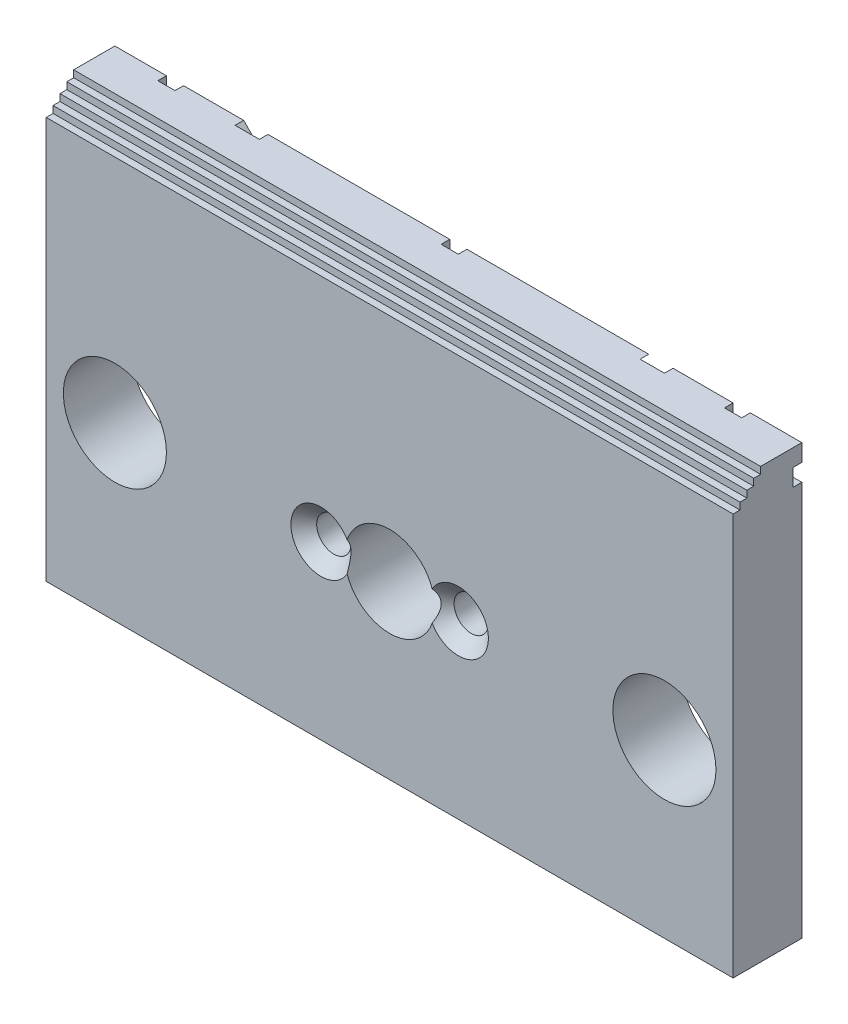
from build123d import *

# Parameters (mm, degrees)
SKETCH_1_W                     = 80
SKETCH_1_H                     = 60
EXTRUDE_1_DEPTH                = 8
HOLE_WIZARD_12_0_12_1_D        = 12
HOLE_WIZARD_10_5_10_5_1_D      = 10.5
HOLE_WIZARD_M3_5_1_D           = 4
HOLE_WIZARD_M3_5_1_CSINK_D     = 7
HOLE_WIZARD_M3_5_1_CSINK_ANGLE = 90
CUT_EXTRUDE_1_DEPTH            = 1
CUT_EXTRUDE_2_REACH            = 95.053
CUT_EXTRUDE_3_REACH            = 94.961
SKETCH_29_W                    = 80
SKETCH_29_H                    = 10


with BuildPart() as part:
    # 草图1 → 凸台-拉伸1 (new body)
    with BuildSketch(Plane(origin=(0, 0, 1), x_dir=(-1, 0, 0), z_dir=(0, 0, -1))):
        with Locations((-40, 16.666666667)):
            Rectangle(SKETCH_1_W, SKETCH_1_H)
    extrude(amount=-EXTRUDE_1_DEPTH)

    # Ø12.0 (12) 直径孔1 (through all)
    with Locations(Plane.XY.offset(9)):
        with Locations((72, 16.666666667), (8, 16.666666667)):
            Hole(HOLE_WIZARD_12_0_12_1_D / 2)

    # Ø10.5 (10.5) 直径孔1 (through all)
    with Locations(Plane(origin=(0, 0, 1), x_dir=(-1, 0, 0), z_dir=(0, 0, -1))):
        with Locations((-40, 16.666666667)):
            Hole(HOLE_WIZARD_10_5_10_5_1_D / 2)

    # M3.5 平头机械螺钉的锥形沉头孔1 (through all)
    with Locations(Plane.XY.offset(9)):
        with Locations((32, 16.666666667), (48, 16.666666667)):
            CounterSinkHole(HOLE_WIZARD_M3_5_1_D / 2, HOLE_WIZARD_M3_5_1_CSINK_D / 2, counter_sink_angle=HOLE_WIZARD_M3_5_1_CSINK_ANGLE)

    # 草图27 → 切除-拉伸1 (cut)
    with BuildSketch(Plane(origin=(0, 0, 1), x_dir=(-1, 0, 0), z_dir=(0, 0, -1))):
        with BuildLine():
            ThreePointArc((-41, 30.666666667), (-40, 29.666666667), (-39, 30.666666667))
            Line((-39, 30.666666667), (-39, 42.666666667))
            Line((-39, 42.666666667), (-21.828427125, 42.666666667))
            Line((-21.828427125, 42.666666667), (-32.414213562, 32.080880229))
            ThreePointArc((-32.414213562, 32.080880229), (-32.414213562, 30.666666667), (-31, 30.666666667))
            Line((-31, 30.666666667), (-19, 42.666666667))
            Line((-19, 42.666666667), (-8, 42.666666667))
            Line((-8, 42.666666667), (-8, 30.666666667))
            ThreePointArc((-8, 30.666666667), (-7, 29.666666667), (-6, 30.666666667))
            Line((-6, 30.666666667), (-6, 42.666666667))
            Line((-6, 42.666666667), (0, 42.666666667))
            Line((0, 42.666666667), (0, 44.666666667))
            Line((0, 44.666666667), (-6, 44.666666667))
            Line((-6, 44.666666667), (-6, 46.666666667))
            Line((-6, 46.666666667), (-8, 46.666666667))
            Line((-8, 46.666666667), (-8, 44.666666667))
            Line((-8, 44.666666667), (-17, 44.666666667))
            Line((-17, 44.666666667), (-15, 46.666666667))
            Line((-15, 46.666666667), (-16.414213562, 48.080880229))
            Line((-16.414213562, 48.080880229), (-19.828427125, 44.666666667))
            Line((-19.828427125, 44.666666667), (-39, 44.666666667))
            Line((-39, 44.666666667), (-39, 46.666666667))
            Line((-39, 46.666666667), (-41, 46.666666667))
            Line((-41, 46.666666667), (-41, 44.666666667))
            Line((-41, 44.666666667), (-60.171572875, 44.666666667))
            Line((-60.171572875, 44.666666667), (-63.585786438, 48.080880229))
            Line((-63.585786438, 48.080880229), (-65, 46.666666667))
            Line((-65, 46.666666667), (-63, 44.666666667))
            Line((-63, 44.666666667), (-72, 44.666666667))
            Line((-72, 44.666666667), (-72, 46.666666667))
            Line((-72, 46.666666667), (-74, 46.666666667))
            Line((-74, 46.666666667), (-74, 44.666666667))
            Line((-74, 44.666666667), (-80, 44.666666667))
            Line((-80, 44.666666667), (-80, 42.666666667))
            Line((-80, 42.666666667), (-74, 42.666666667))
            Line((-74, 42.666666667), (-74, 30.666666667))
            ThreePointArc((-74, 30.666666667), (-73, 29.666666667), (-72, 30.666666667))
            Line((-72, 30.666666667), (-72, 42.666666667))
            Line((-72, 42.666666667), (-61, 42.666666667))
            Line((-61, 42.666666667), (-49, 30.666666667))
            ThreePointArc((-49, 30.666666667), (-47.585786438, 30.666666667), (-47.585786438, 32.080880229))
            Line((-47.585786438, 32.080880229), (-58.171572875, 42.666666667))
            Line((-58.171572875, 42.666666667), (-41, 42.666666667))
            Line((-41, 42.666666667), (-41, 30.666666667))
        make_face()
    extrude(amount=-CUT_EXTRUDE_1_DEPTH, mode=Mode.SUBTRACT)

    # 草图28 → 切除-拉伸2 (cut, up to next)
    with BuildSketch(Plane.ZY, mode=Mode.PRIVATE) as cut_extrude_2_sk1:
        Polygon((9, 46.666666667), (5.8, 46.666666667), (5.8, 45.866666667), (6.6, 45.866666667), (6.6, 45.066666667), (7.4, 45.066666667), (7.4, 44.266666667), (8.2, 44.266666667), (8.2, 43.466666667), (9, 43.466666667), align=None)
    cut_extrude_2_tool1 = extrude(cut_extrude_2_sk1.sketch, amount=-CUT_EXTRUDE_2_REACH, mode=Mode.PRIVATE) & part.part
    add(cut_extrude_2_tool1.solids().sort_by_distance((0, 45.466667, 7.8))[0], mode=Mode.SUBTRACT)

    # 草图29 → 切除-拉伸3 (cut, up to next)
    with BuildSketch(Plane(origin=(0, 0, 1), x_dir=(-1, 0, 0), z_dir=(0, 0, -1)), mode=Mode.PRIVATE) as cut_extrude_3_sk1:
        with Locations((-40, -8.333333333)):
            Rectangle(SKETCH_29_W, SKETCH_29_H)
    cut_extrude_3_tool1 = extrude(cut_extrude_3_sk1.sketch, amount=-CUT_EXTRUDE_3_REACH, mode=Mode.PRIVATE) & part.part
    add(cut_extrude_3_tool1.solids().sort_by_distance((40, -8.333333, 1))[0], mode=Mode.SUBTRACT)


solid = part.part
